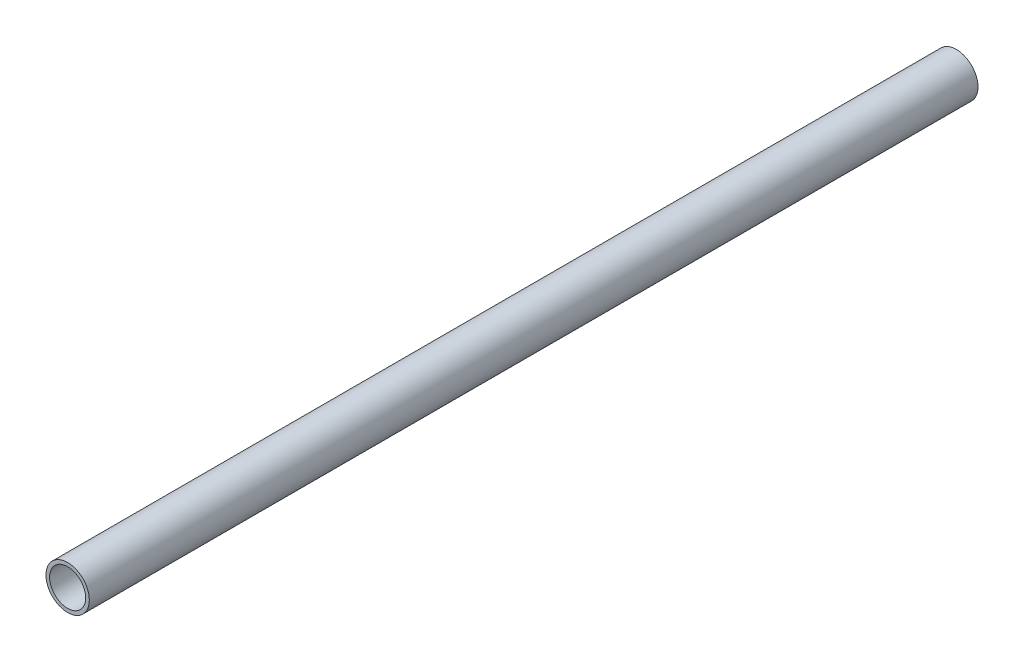
from build123d import *

# Parameters (mm, degrees)
SKETCH1_R           = 6
SKETCH1_R_2         = 5
BOSS_EXTRUDE1_DEPTH = 246


with BuildPart() as part:
    # Sketch1 → Boss-Extrude1 (new body)
    with BuildSketch(Plane.XY):
        Circle(SKETCH1_R)
        Circle(SKETCH1_R_2, mode=Mode.SUBTRACT)
    extrude(amount=BOSS_EXTRUDE1_DEPTH)


solid = part.part
